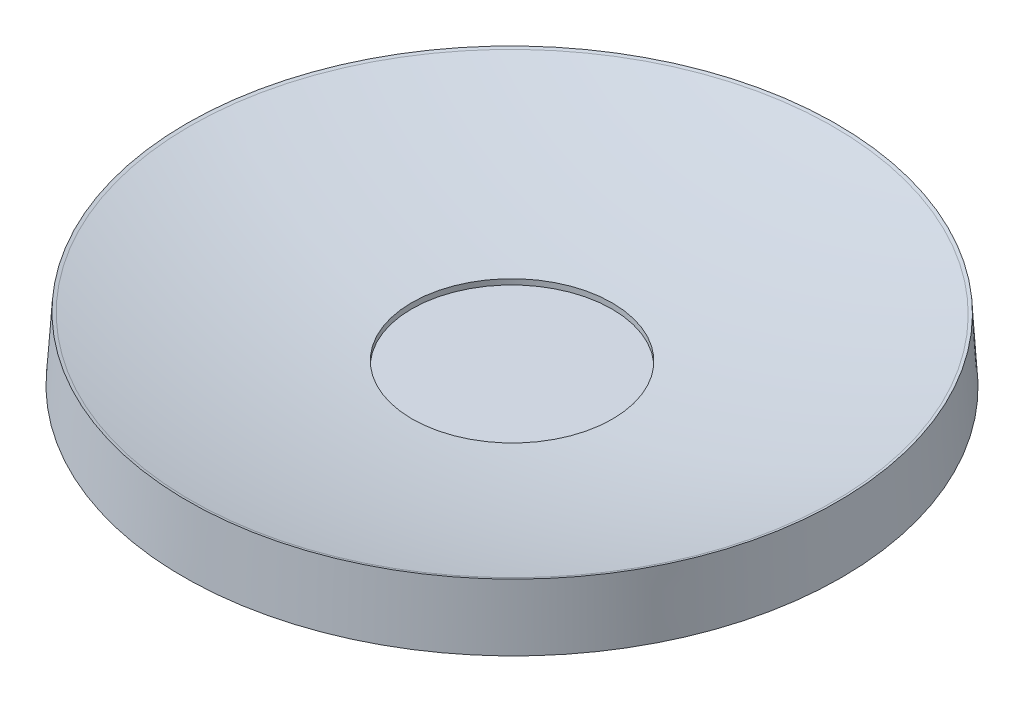
from build123d import *


with BuildPart() as part:
    # Çizim2 → Döndür4 (revolve)
    with BuildSketch(Plane.XY, mode=Mode.PRIVATE) as d_nd_r4_sk:
        with BuildLine():
            Line((0.007868423, 2.447551496), (0, 0))
            Line((0, 0), (0.029070392, 0))
            ThreePointArc((0.029070392, 0), (6.663636067, 0.442575925), (13.180632211, 1.762460918))
            Line((13.180632211, 1.762460918), (13.025393844, 4.311738481))
            Line((13.025393844, 4.311738481), (12.905238293, 4.277863766))
            ThreePointArc((12.905238293, 4.277863766), (8.500440894, 3.259791078), (4.018750105, 2.665518584))
            Line((4.018750105, 2.665518584), (4.018750105, 2.447549997))
            Line((4.018750105, 2.447549997), (0.007868423, 2.447551496))
        make_face()
    revolve(d_nd_r4_sk.sketch.rotate(Axis((0.007868423, 2.447551496, 0), (-0.0032147973142897033, -0.9999948325257627, 0)), 180), axis=Axis((0.007868423, 2.447551496, 0), (-0.0032147973142897033, -0.9999948325257627, 0)))


solid = part.part
